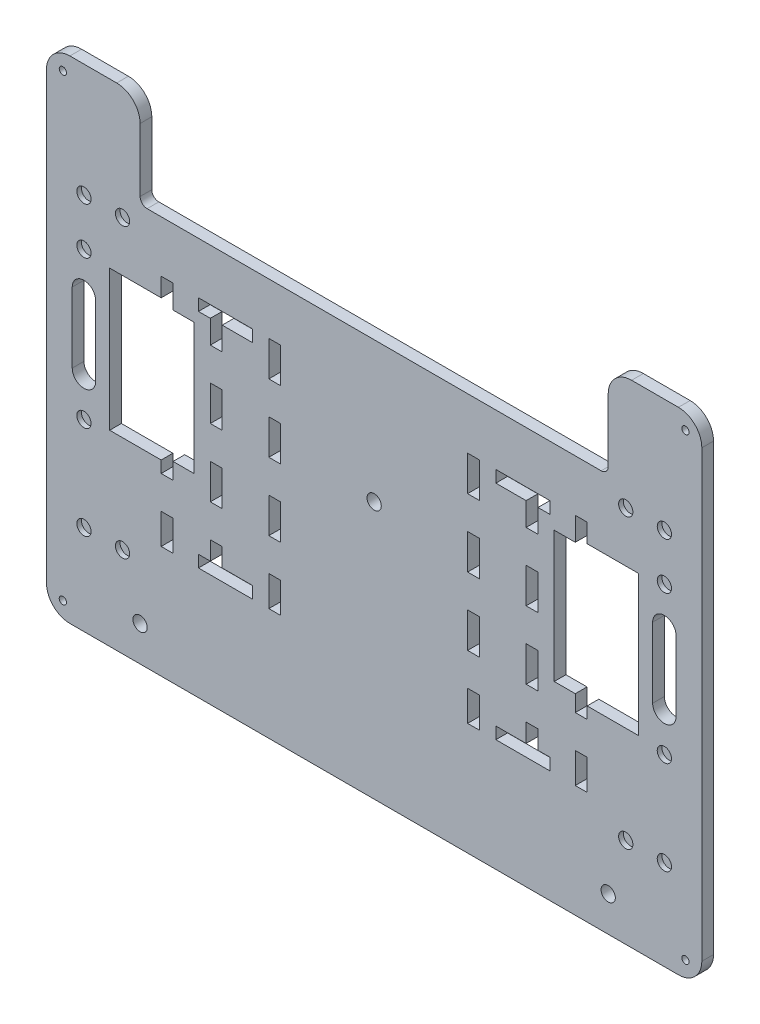
from build123d import *

# Parameters (mm, degrees)
BOSS_EXTRU_1_DEPTH      = 5
ESQUISSE2_W             = 5.07
ESQUISSE2_H             = 13
ESQUISSE2_H_2           = 15
ENL_V_MAT_EXTRU_1_DEPTH = 10
ESQUISSE3_R             = 3.05
ENL_V_MAT_EXTRU_2_DEPTH = 2
ENL_V_MAT_EXTRU_3_DEPTH = 176.071414
ESQUISSE5_R             = 3.05
ESQUISSE5_R_2           = 1.55
ENL_V_MAT_EXTRU_4_DEPTH = 176.071414


with BuildPart() as part:
    # Esquisse1 → Boss.-Extru.1 (new body)
    with BuildSketch(Plane.XY):
        with BuildLine():
            Line((130, -105), (-130, -105))
            ThreePointArc((-130, -105), (-137.071067812, -102.071067812), (-140, -95))
            Line((-140, -95), (-140, 105))
            Line((-140, 105), (140, 105))
            Line((140, 105), (140, -95))
            ThreePointArc((140, -95), (137.071067812, -102.071067812), (130, -105))
        make_face()
    extrude(amount=BOSS_EXTRU_1_DEPTH)

    # Esquisse2 → Enlèv. mat.-Extru.1 (cut)
    with BuildSketch(Plane.XY.offset(5)):
        Polygon((-91, 35), (-113, 35), (-113, -25), (-91, -25), (-91, -30), (-85.93, -30), (-85.93, -23), (-76.93, -23), (-76.93, 33), (-85.93, 33), (-85.93, 43), (-91, 43), align=None)
        with Locations((-88.465, -50.5)):
            Rectangle(ESQUISSE2_W, ESQUISSE2_H)
        with Locations((-67.465, 6.5)):
            Rectangle(ESQUISSE2_W, ESQUISSE2_H_2)
        Polygon((-70, 28), (-64.93, 28), (-64.93, 37.93), (-52, 37.93), (-52, 43), (-75.07, 43), (-75.07, 37.93), (-70, 37.93), align=None)
        Polygon((-52, -57), (-52, -51.93), (-64.93, -51.93), (-64.93, -44), (-70, -44), (-70, -51.93), (-75.07, -51.93), (-75.07, -57), align=None)
        with Locations((-67.465, -22.5)):
            Rectangle(ESQUISSE2_W, ESQUISSE2_H_2)
        with Locations((-42.465, 6.5)):
            Rectangle(ESQUISSE2_W, ESQUISSE2_H_2)
        with Locations((-42.465, 35.5)):
            Rectangle(ESQUISSE2_W, ESQUISSE2_H_2)
        with Locations((-42.465, -50.5)):
            Rectangle(ESQUISSE2_W, ESQUISSE2_H)
        with Locations((-42.465, -22.5)):
            Rectangle(ESQUISSE2_W, ESQUISSE2_H_2)
        Polygon((52, -51.93), (52, -57), (75.07, -57), (75.07, -51.93), (70, -51.93), (70, -44), (64.93, -44), (64.93, -51.93), align=None)
        Polygon((52, 43), (52, 37.93), (64.93, 37.93), (64.93, 28), (70, 28), (70, 37.93), (75.07, 37.93), (75.07, 43), align=None)
        with Locations((42.465, -50.5)):
            Rectangle(ESQUISSE2_W, ESQUISSE2_H)
        with Locations((42.465, -22.5)):
            Rectangle(ESQUISSE2_W, ESQUISSE2_H_2)
        with Locations((42.465, 6.5)):
            Rectangle(ESQUISSE2_W, ESQUISSE2_H_2)
        with Locations((42.465, 35.5)):
            Rectangle(ESQUISSE2_W, ESQUISSE2_H_2)
        with Locations((67.465, -22.5)):
            Rectangle(ESQUISSE2_W, ESQUISSE2_H_2)
        with Locations((67.465, 6.5)):
            Rectangle(ESQUISSE2_W, ESQUISSE2_H_2)
        with Locations((88.465, -50.5)):
            Rectangle(ESQUISSE2_W, ESQUISSE2_H)
        Polygon((85.93, -30), (91, -30), (91, -25), (113, -25), (113, 35), (91, 35), (91, 43), (85.93, 43), (85.93, 33), (76.93, 33), (76.93, -23), (85.93, -23), align=None)
    extrude(amount=-ENL_V_MAT_EXTRU_1_DEPTH, mode=Mode.SUBTRACT)

    # Esquisse3 → Enlèv. mat.-Extru.2 (cut)
    with BuildSketch(Plane.XY.offset(5)):
        with Locations((-124, -26.5)):
            Circle(ESQUISSE3_R)
        with Locations((-124, 36.5)):
            Circle(ESQUISSE3_R)
        with Locations(Location((124, 36.5, 0), (0, 0, 180))):
            Circle(ESQUISSE3_R)
        with Locations(Location((124, -26.5, 0), (0, 0, 180))):
            Circle(ESQUISSE3_R)
        with Locations((-124, 56.5)):
            Circle(ESQUISSE3_R)
        with Locations((-107.5, 56.5)):
            Circle(ESQUISSE3_R)
        with Locations((-124, -66.5)):
            Circle(ESQUISSE3_R)
        with Locations((-107.5, -66.5)):
            Circle(ESQUISSE3_R)
        with Locations(Location((107.5, -66.5, 0), (0, 0, 180))):
            Circle(ESQUISSE3_R)
        with Locations(Location((124, -66.5, 0), (0, 0, 180))):
            Circle(ESQUISSE3_R)
        with Locations(Location((107.5, 56.5, 0), (0, 0, 180))):
            Circle(ESQUISSE3_R)
        with Locations(Location((124, 56.5, 0), (0, 0, 180))):
            Circle(ESQUISSE3_R)
    extrude(amount=-ENL_V_MAT_EXTRU_2_DEPTH, mode=Mode.SUBTRACT)

    # Esquisse4 → Enlèv. mat.-Extru.3 (cut, through all)
    with BuildSketch(Plane.XY.offset(5)):
        with BuildLine():
            Line((-119, 20), (-119, -10))
            ThreePointArc((-119, -10), (-124, -15), (-129, -10))
            Line((-129, -10), (-129, 20))
            ThreePointArc((-129, 20), (-124, 25), (-119, 20))
        make_face()
        with BuildLine():
            Line((119, 20), (119, -10))
            ThreePointArc((119, -10), (124, -15), (129, -10))
            Line((129, -10), (129, 20))
            ThreePointArc((129, 20), (124, 25), (119, 20))
        make_face()
        with BuildLine():
            Line((-110, 105), (110, 105))
            ThreePointArc((110, 105), (102.928932188, 102.071067812), (100, 95))
            Line((100, 95), (100, 68))
            ThreePointArc((100, 68), (99.121320344, 65.878679656), (97, 65))
            Line((97, 65), (-97, 65))
            ThreePointArc((-97, 65), (-99.121320344, 65.878679656), (-100, 68))
            Line((-100, 68), (-100, 95))
            ThreePointArc((-100, 95), (-102.928932188, 102.071067812), (-110, 105))
        make_face()
        with BuildLine():
            Line((140, 105), (130, 105))
            ThreePointArc((130, 105), (137.071067812, 102.071067812), (140, 95))
            Line((140, 95), (140, 105))
        make_face()
        with BuildLine():
            Line((-140, 95), (-140, 105))
            Line((-140, 105), (-130, 105))
            ThreePointArc((-130, 105), (-137.071067812, 102.071067812), (-140, 95))
        make_face()
    extrude(amount=-ENL_V_MAT_EXTRU_3_DEPTH, mode=Mode.SUBTRACT)

    # Esquisse5 → Enlèv. mat.-Extru.4 (cut, through all)
    with BuildSketch(Plane.XY.offset(5)):
        with Locations((0, 5)):
            Circle(ESQUISSE5_R)
        with Locations((-133, 98)):
            Circle(ESQUISSE5_R_2)
        with Locations((-100, -90)):
            Circle(ESQUISSE5_R)
        with Locations((-133, -98)):
            Circle(ESQUISSE5_R_2)
        with Locations((133, -98)):
            Circle(ESQUISSE5_R_2)
        with Locations((100, -90)):
            Circle(ESQUISSE5_R)
        with Locations((133, 98)):
            Circle(ESQUISSE5_R_2)
    extrude(amount=-ENL_V_MAT_EXTRU_4_DEPTH, mode=Mode.SUBTRACT)


solid = part.part
